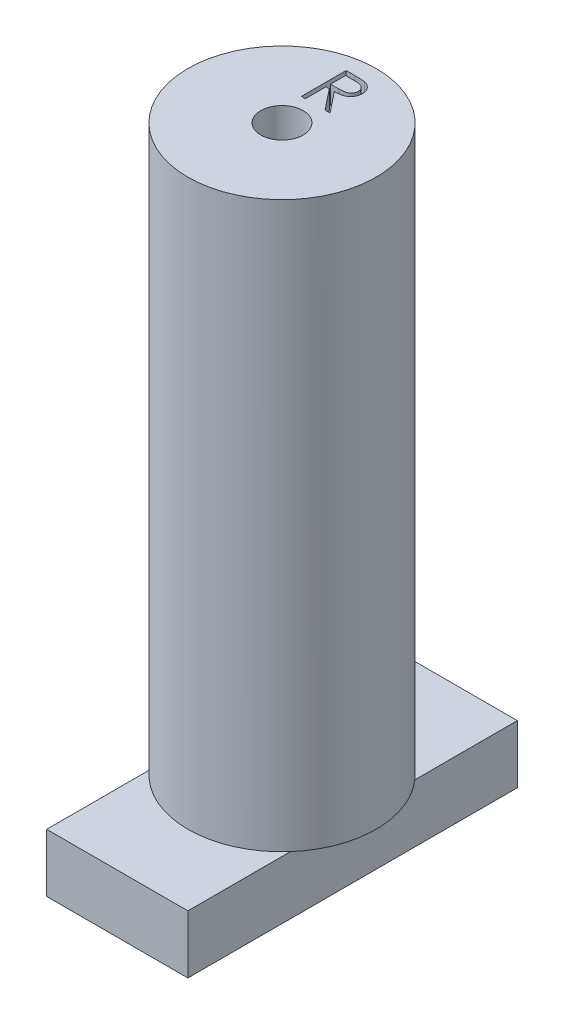
from build123d import *

# Parameters (mm, degrees)
SKETCH1_R           = 10
BOSS_EXTRUDE1_DEPTH = 4
SKETCH2_R           = 10
SKETCH2_R_2         = 8
SKETCH2_R_3         = 3.5
BOSS_EXTRUDE2_DEPTH = 52
SKETCH3_R           = 10
BOSS_EXTRUDE3_DEPTH = 4
CUT_EXTRUDE1_DEPTH  = 2
SKETCH5_R           = 2.25
CUT_EXTRUDE2_DEPTH  = 50
SKETCH6_W           = 15
SKETCH6_H           = 35
BOSS_EXTRUDE4_DEPTH = 6.18
SKETCH7_W           = 3.18
SKETCH7_H           = 13
CUT_EXTRUDE3_DEPTH  = 4.18


with BuildPart() as part:
    # Sketch1 → Boss-Extrude1 (new body)
    with BuildSketch(Plane(origin=(0, 0, 0), x_dir=(1, 0, 0), z_dir=(0, 1, 0))):
        with Locations(Location((0, 0, 0), (0, 0, 270))):
            Circle(SKETCH1_R)
    extrude(amount=BOSS_EXTRUDE1_DEPTH)

    # Sketch2 → Boss-Extrude2 (add)
    # profile 1 of 2: a face of its own
    with BuildSketch(Plane(origin=(0, 4, 0), x_dir=(1, 0, 0), z_dir=(0, 1, 0))):
        with Locations(Location((0, 0, 0), (0, 0, 270))):
            Circle(SKETCH2_R)
        with Locations(Location((0, 0, 0), (0, 0, 90))):
            Circle(SKETCH2_R_2, mode=Mode.SUBTRACT)
    # profile 2 of 2: a face of its own
    with BuildSketch(Plane(origin=(0, 4, 0), x_dir=(1, 0, 0), z_dir=(0, 1, 0))):
        with Locations(Location((0, 0, 0), (0, 0, 90))):
            Circle(SKETCH2_R_3)
    extrude(amount=BOSS_EXTRUDE2_DEPTH)

    # Sketch3 → Boss-Extrude3 (add)
    with BuildSketch(Plane(origin=(0, 56, 0), x_dir=(1, 0, 0), z_dir=(0, 1, 0))):
        with Locations(Location((0, 0, 0), (0, 0, 270))):
            Circle(SKETCH3_R)
    extrude(amount=BOSS_EXTRUDE3_DEPTH)

    # Sketch4 → Cut-Extrude1 (cut)
    with BuildSketch(Plane(origin=(0, 60, 0), x_dir=(1, 0, 0), z_dir=(0, 1, 0))):
        with BuildLine():
            Line((-1.404326923, 8.220249015), (-0.451254507, 8.220249015))
            add(Edge.make_bspline(
                [(-0.451254507, 8.220249015), (-0.387653186, 8.220037307), (-0.265531604, 8.219630804), (-0.090580118, 8.217364176), (0.068388182, 8.210867642), (0.211290178, 8.205277034), (0.338123247, 8.195082643), (0.449276311, 8.185339048), (0.544237428, 8.172584174), (0.601721961, 8.16073858), (0.627749399, 8.155375217)],
                knots=[0, 0, 0, 0, 1.410062039, 2.707475311, 3.878576406, 4.937260626, 5.877586885, 6.699081471, 7.410979367, 8, 8, 8, 8], degree=3))
            add(Edge.make_bspline(
                [(0.627749399, 8.155375217), (0.662592698, 8.146766297), (0.731535995, 8.129732108), (0.830800192, 8.093728152), (0.925389325, 8.052063591), (1.014910479, 8.003127243), (1.098915252, 7.946555846), (1.178269811, 7.883326008), (1.253334245, 7.813783703), (1.32107282, 7.73617558), (1.384943458, 7.654755186), (1.438812268, 7.56671186), (1.485248657, 7.474643853), (1.522219967, 7.377614831), (1.551989638, 7.276565777), (1.572980343, 7.170581378), (1.585568566, 7.06014448), (1.586850162, 6.984818183), (1.5875, 6.946623714)],
                knots=[0, 0, 0, 0, 1.027469482, 2.033020251, 3.019912614, 3.986113645, 4.951240523, 5.91722682, 6.890402269, 7.87763091, 8.8651537, 9.85103654, 10.82876324, 11.815024772, 12.821070561, 13.842952187, 14.906261191, 16, 16, 16, 16], degree=3))
            add(Edge.make_bspline(
                [(1.5875, 6.946623714), (1.585501113, 6.883166661), (1.581600768, 6.759345515), (1.545235537, 6.579648387), (1.485668201, 6.412022927), (1.40358544, 6.256680195), (1.299056082, 6.116648209), (1.17342842, 5.993652625), (1.02663237, 5.890728316), (0.889976765, 5.819355035), (0.769262086, 5.773644684), (0.669884614, 5.741482353), (0.56148062, 5.716633036), (0.445088747, 5.694371571), (0.32022463, 5.677564444), (0.187187541, 5.665254614), (0.045882599, 5.657561069), (-0.051189492, 5.656415341), (-0.101126803, 5.655825938)],
                knots=[0, 0, 0, 0, 1.260483769, 2.459530307, 3.627416485, 4.787058657, 5.939039949, 7.08810263, 8.267026773, 9.491475466, 10.141966685, 10.831826277, 11.566392101, 12.351337768, 13.187381173, 14.07005841, 15.007169909, 16, 16, 16, 16], degree=3))
            Line((-0.101126803, 5.655825938), (1.648557692, 3.457749015))
            Line((1.648557692, 3.457749015), (1.120027043, 3.457749015))
            Line((1.120027043, 3.457749015), (-0.629657452, 5.655825938))
            Line((-0.629657452, 5.655825938), (-0.976923077, 5.655825938))
            Line((-0.976923077, 5.655825938), (-0.976923077, 3.457749015))
            Line((-0.976923077, 3.457749015), (-1.404326923, 3.457749015))
            Line((-1.404326923, 3.457749015), (-1.404326923, 8.220249015))
        make_face()
        with BuildLine():
            Line((-0.976923077, 7.731787476), (-0.976923077, 6.144287476))
            Line((-0.976923077, 6.144287476), (-0.104942909, 6.137609291))
            add(Edge.make_bspline(
                [(-0.104942909, 6.137609291), (-0.064230284, 6.13759128), (0.014682377, 6.137556369), (0.128847211, 6.142990757), (0.235146363, 6.149172915), (0.333173243, 6.158628989), (0.422971644, 6.170815644), (0.504496681, 6.186059705), (0.577881434, 6.203819833), (0.663468374, 6.231308474), (0.759040225, 6.27485952), (0.862905533, 6.338221859), (0.951355143, 6.417917696), (1.026082663, 6.509049435), (1.08613021, 6.60924733), (1.128464827, 6.717310318), (1.15532865, 6.830510314), (1.158497136, 6.908313383), (1.160096154, 6.947577741)],
                knots=[0, 0, 0, 0, 1.146690395, 2.22261258, 3.21895312, 4.145990853, 4.996080663, 5.770904154, 6.481378293, 7.121626537, 8.300444488, 9.431385265, 10.535395872, 11.636531494, 12.74115979, 13.810798291, 14.895190096, 16, 16, 16, 16], degree=3))
            add(Edge.make_bspline(
                [(1.160096154, 6.947577741), (1.158460411, 6.985877186), (1.155218964, 7.061772711), (1.128754747, 7.172883074), (1.084001696, 7.277749174), (1.023691794, 7.37594442), (0.950214372, 7.46507901), (0.86405692, 7.541343172), (0.767575208, 7.60427548), (0.677399041, 7.644490547), (0.596798202, 7.66914649), (0.526817129, 7.686497181), (0.447744011, 7.700436976), (0.359194905, 7.711605802), (0.261547829, 7.721205566), (0.15430905, 7.727671379), (0.038190074, 7.731500244), (-0.042292, 7.731689504), (-0.083954327, 7.731787476)],
                knots=[0, 0, 0, 0, 1.101028733, 2.181837193, 3.264309656, 4.369019818, 5.486613113, 6.575447106, 7.666700264, 8.788928104, 9.402425223, 10.0903467, 10.862060571, 11.710948788, 12.657782767, 13.684531032, 14.801375019, 16, 16, 16, 16], degree=3))
            Line((-0.083954327, 7.731787476), (-0.976923077, 7.731787476))
        make_face(mode=Mode.SUBTRACT)
    extrude(amount=-CUT_EXTRUDE1_DEPTH, mode=Mode.SUBTRACT)

    # Sketch5 → Cut-Extrude2 (cut)
    with BuildSketch(Plane(origin=(0, 60, 0), x_dir=(1, 0, 0), z_dir=(0, 1, 0))):
        with Locations(Location((0, 0, 0), (0, 0, 270))):
            Circle(SKETCH5_R)
    extrude(amount=-CUT_EXTRUDE2_DEPTH, mode=Mode.SUBTRACT)

    # Sketch6 → Boss-Extrude4 (add)
    with BuildSketch(Plane.XZ):
        Rectangle(SKETCH6_W, SKETCH6_H)
    extrude(amount=BOSS_EXTRUDE4_DEPTH)

    # Sketch7 → Cut-Extrude3 (cut)
    with BuildSketch(Plane.XZ.offset(6.18)):
        Rectangle(SKETCH7_W, SKETCH7_H)
    extrude(amount=-CUT_EXTRUDE3_DEPTH, mode=Mode.SUBTRACT)


solid = part.part
